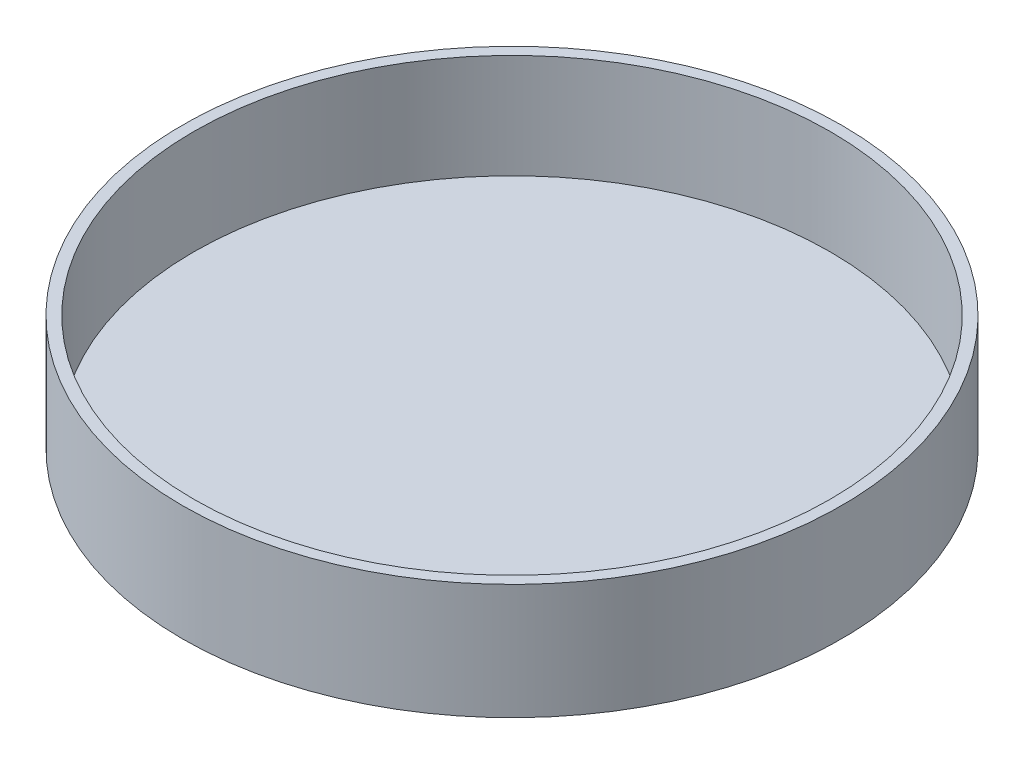
from build123d import *


with BuildPart() as part:
    # Esquisse1 → Révolution1 (revolve)
    with BuildSketch(Plane.XY, mode=Mode.PRIVATE) as r_volution1_sk:
        Polygon((0, 0), (44.25, 0), (44.25, 15.5), (42.75, 15.5), (42.75, 1.5), (0, 1.5), align=None)
    revolve(r_volution1_sk.sketch.rotate(Axis((0, 0, 0), (0, 1, 0)), 90), axis=Axis((0, 0, 0), (0, 1, 0)))


solid = part.part
